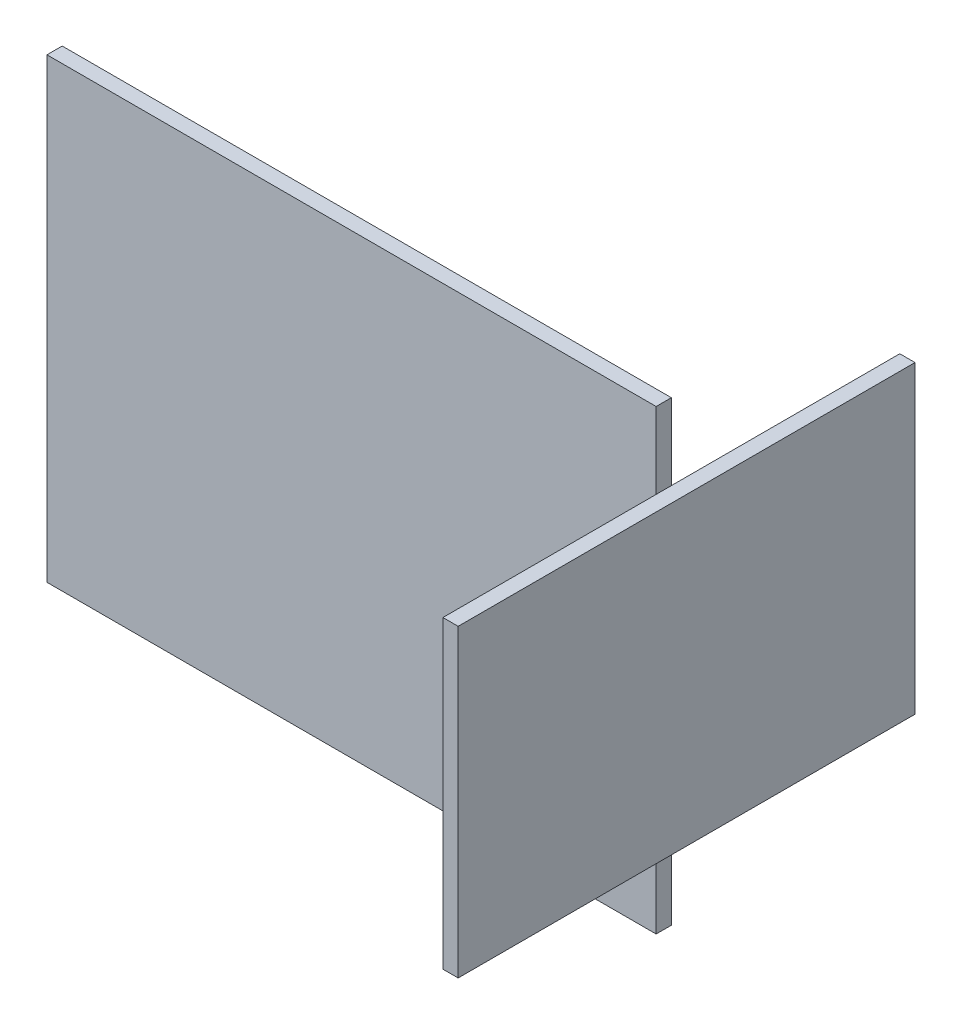
from build123d import *

# Parameters (mm, degrees)
SKETCH_2_W      = 80
SKETCH_2_H      = 60
EXTRUDE_1_DEPTH = 2
SKETCH_3_W      = 60
SKETCH_3_H      = 40
EXTRUDE_2_DEPTH = 2


with BuildPart() as part:
    # 草图2 → 凸台-拉伸1 (new body)
    with BuildSketch(Plane.XY):
        Rectangle(SKETCH_2_W, SKETCH_2_H)
    extrude(amount=EXTRUDE_1_DEPTH)

    # 草图3 → 凸台-拉伸2 (add)
    with BuildSketch(Plane(origin=(40, 0, 0), x_dir=(0, 0, -1), z_dir=(1, 0, 0))):
        Rectangle(SKETCH_3_W, SKETCH_3_H)
    extrude(amount=EXTRUDE_2_DEPTH)


solid = part.part
